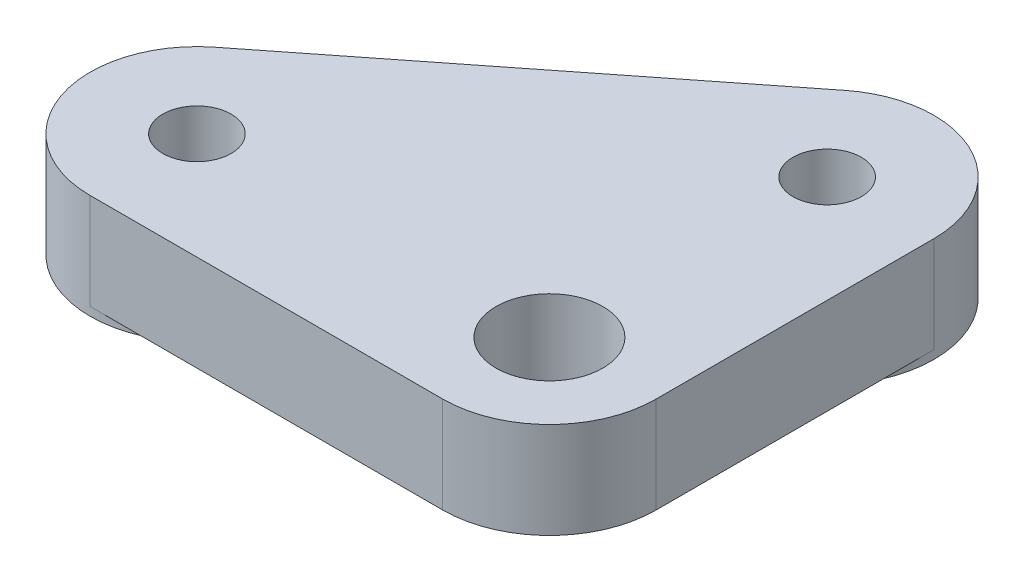
from build123d import *

# Parameters (mm, degrees)
SKETCH1_R           = 1.6
SKETCH1_R_2         = 2.5
BOSS_EXTRUDE1_DEPTH = 1.57
FILLET1_R           = 5
SKETCH2_R           = 2.5
SKETCH2_R_2         = 1.6
BOSS_EXTRUDE2_DEPTH = 2.93
SKETCH3_R           = 5
SKETCH3_R_2         = 1.6
BOSS_EXTRUDE3_DEPTH = 0.4


with BuildPart() as part:
    # Sketch1 → Boss-Extrude1 (new body)
    with BuildSketch(Plane(origin=(0, 0, 0), x_dir=(1, 0, 0), z_dir=(0, 1, 0))):
        Polygon((-5, -5), (30.925365976, -5), (-5, 23.304833799), align=None)
        with Locations(Location((16.5, 0, 0), (0, 0, 270))):
            Circle(SKETCH1_R, mode=Mode.SUBTRACT)
        with Locations(Location((0, 0, 0), (0, 0, 270))):
            Circle(SKETCH1_R_2, mode=Mode.SUBTRACT)
        with Locations(Location((0, 13, 0), (0, 0, 270))):
            Circle(SKETCH1_R, mode=Mode.SUBTRACT)
    extrude(amount=BOSS_EXTRUDE1_DEPTH)

    # Fillet1
    fillet1_edges = [part.edges().sort_by_distance(p)[0] for p in [
        (-5, 0.785, -23.304833799),
        (30.925365976, 0.785, 5),
        (-5, 0.785, 5),
    ]]
    fillet(fillet1_edges, radius=FILLET1_R)

    # Sketch2 → Boss-Extrude2 (add)
    with BuildSketch(Plane(origin=(0, 1.57, 0), x_dir=(1, 0, 0), z_dir=(0, 1, 0))):
        with BuildLine():
            Line((19.594361133, 3.927458361), (3.094361133, 16.927458361))
            ThreePointArc((3.094361133, 16.927458361), (-2.182681188, 17.498433375), (-5, 13))
            Line((-5, 13), (-5, 0))
            ThreePointArc((-5, 0), (-3.535533906, -3.535533906), (0, -5))
            Line((0, -5), (16.5, -5))
            ThreePointArc((16.5, -5), (21.224261413, -1.637484075), (19.594361133, 3.927458361))
        make_face()
        with Locations(Location((0, 0, 0), (0, 0, 270))):
            Circle(SKETCH2_R, mode=Mode.SUBTRACT)
        with Locations(Location((16.5, 0, 0), (0, 0, 270))):
            Circle(SKETCH2_R_2, mode=Mode.SUBTRACT)
        with Locations(Location((0, 13, 0), (0, 0, 270))):
            Circle(SKETCH2_R_2, mode=Mode.SUBTRACT)
    extrude(amount=BOSS_EXTRUDE2_DEPTH)

    # Sketch3 → Boss-Extrude3 (add)
    # profile 1 of 2: a face of its own
    with BuildSketch(Plane.XZ):
        with Locations(Location((16.5, 0, 0), (0, 0, 270))):
            Circle(SKETCH3_R)
        with Locations(Location((16.5, 0, 0), (0, 0, 270))):
            Circle(SKETCH3_R_2, mode=Mode.SUBTRACT)
    # profile 2 of 2: a face of its own
    with BuildSketch(Plane.XZ):
        with Locations(Location((0, -13, 0), (0, 0, 270))):
            Circle(SKETCH3_R)
        with Locations(Location((0, -13, 0), (0, 0, 270))):
            Circle(SKETCH3_R_2, mode=Mode.SUBTRACT)
    extrude(amount=BOSS_EXTRUDE3_DEPTH)


with BuildPart() as body_2:
    # Mirror1: mirrored copy
    add(part.part.mirror(Plane(origin=(-5, 1.57, -23.304833799), x_dir=(0, 0, 1), z_dir=(1, 0, 0))))


solid = body_2.part
